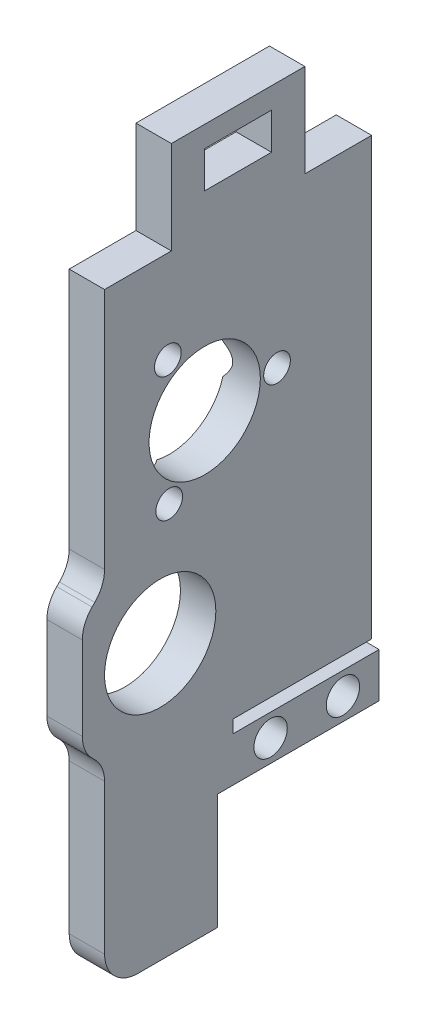
from build123d import *

# Parameters (mm, degrees)
BOSS_EXTRUDE1_DEPTH                             = 3.18
SKETCH2_4_OUTSIDE_W                             = 40.864
SKETCH2_4_OUTSIDE_H                             = 68.924
SKETCH2_4_OUTSIDE_R                             = 5
CUT_EXTRUDE2_DEPTH                              = 3.18
FILLET6_R                                       = 3
CSK_FOR_M2_FLAT_HEAD_MACHINE_SCREW2_D           = 2.4
CSK_FOR_M2_FLAT_HEAD_MACHINE_SCREW2_CSINK_D     = 4.4
CSK_FOR_M2_FLAT_HEAD_MACHINE_SCREW2_CSINK_ANGLE = 90
M3X0_5_TAPPED_HOLE1_D                           = 3
M3X0_5_TAPPED_HOLE1_DEPTH                       = 3.328709071
M3X0_5_TAPPED_HOLE1_TIP                         = 0.901290929
SKETCH16_W                                      = 3.18
SKETCH16_H                                      = 12
BOSS_EXTRUDE2_DEPTH                             = 8.36
SKETCH18_W                                      = 6
SKETCH18_H                                      = 3.28
CUT_EXTRUDE3_DEPTH                              = 68.816439015


with BuildPart() as part:
    # Sketch2 → Boss-Extrude1 (new body)
    with BuildSketch(Plane(origin=(0, 0, 0), x_dir=(0, 0, -1), z_dir=(1, 0, 0))):
        Polygon((0, 54.73), (24, 54.73), (24, 15.53), (11.52, 15.53), (11.52, 14.38), (24.67, 14.38), (24.67, 10.38), (10.17, 10.38), (10.17, 0), (0, 0), (0, 17.7), (-2, 19.7), (-2, 29.7), (0, 31.7), align=None)
    extrude(amount=-BOSS_EXTRUDE1_DEPTH)

    # Sketch2<4> outside → Cut-Extrude2 (cut)
    # profile 1 of 3: a face of its own
    with BuildSketch(Plane(origin=(0, 0, 0), x_dir=(0, 0, -1), z_dir=(1, 0, 0))):
        with Locations((11.335, 27.365)):
            Rectangle(SKETCH2_4_OUTSIDE_W, SKETCH2_4_OUTSIDE_H)
        Polygon((0, 54.73), (24, 54.73), (24, 15.53), (11.52, 15.53), (11.52, 14.38), (24.67, 14.38), (24.67, 10.38), (10.17, 10.38), (10.17, 0), (0, 0), (0, 17.7), (-2, 19.7), (-2, 29.7), (0, 31.7), align=None, mode=Mode.SUBTRACT)
    # profile 2 of 3: a face of its own
    with BuildSketch(Plane(origin=(0, 0, 0), x_dir=(0, 0, -1), z_dir=(1, 0, 0))):
        with Locations((5, 24.7)):
            Circle(SKETCH2_4_OUTSIDE_R)
    # profile 3 of 3: a face of its own
    with BuildSketch(Plane(origin=(0, 0, 0), x_dir=(0, 0, -1), z_dir=(1, 0, 0))):
        with Locations((9, 40.810865899)):
            Circle(SKETCH2_4_OUTSIDE_R)
    extrude(amount=-CUT_EXTRUDE2_DEPTH, mode=Mode.SUBTRACT)

    # Fillet6
    fillet6_edges = [part.edges().sort_by_distance(p)[0] for p in [
        (-1.59, 31.7, 0),
        (-1.59, 29.7, 2),
        (-1.59, 19.7, 2),
        (-1.59, 17.7, 0),
        (-1.59, 0, 0),
    ]]
    fillet(fillet6_edges, radius=FILLET6_R)

    # CSK for M2 Flat Head Machine Screw2 (through all)
    with Locations(Plane.ZY.offset(3.18)):
        with Locations((-5.688374042, 46.403998609), (-15.499607993, 40.882251751), (-5.812017965, 35.146347336)):
            CounterSinkHole(CSK_FOR_M2_FLAT_HEAD_MACHINE_SCREW2_D / 2, CSK_FOR_M2_FLAT_HEAD_MACHINE_SCREW2_CSINK_D / 2, counter_sink_angle=CSK_FOR_M2_FLAT_HEAD_MACHINE_SCREW2_CSINK_ANGLE)

    # M3x0.5 Tapped Hole1
    with Locations(Plane(origin=(0, 0, 0), x_dir=(0, 0, -1), z_dir=(1, 0, 0))):
        with Locations((21.42, 12.38), (14.92, 12.38)):
            Hole(M3X0_5_TAPPED_HOLE1_D / 2, depth=M3X0_5_TAPPED_HOLE1_DEPTH)
            with Locations((0, 0, -(M3X0_5_TAPPED_HOLE1_DEPTH + M3X0_5_TAPPED_HOLE1_TIP / 2))):  # 118° drill point
                Cone(0, M3X0_5_TAPPED_HOLE1_D / 2, M3X0_5_TAPPED_HOLE1_TIP, mode=Mode.SUBTRACT)

    # Sketch16 → Boss-Extrude2 (add)
    with BuildSketch(Plane(origin=(0, 54.73, 0), x_dir=(1, 0, 0), z_dir=(0, 1, 0))):
        with Locations((-1.59, 12)):
            Rectangle(SKETCH16_W, SKETCH16_H)
    extrude(amount=BOSS_EXTRUDE2_DEPTH)

    # Sketch18 → Cut-Extrude3 (cut, through all)
    with BuildSketch(Plane(origin=(0, 0, 0), x_dir=(0, 0, -1), z_dir=(1, 0, 0))):
        with Locations((12, 59.55)):
            Rectangle(SKETCH18_W, SKETCH18_H)
    extrude(amount=-CUT_EXTRUDE3_DEPTH, mode=Mode.SUBTRACT)


solid = part.part
